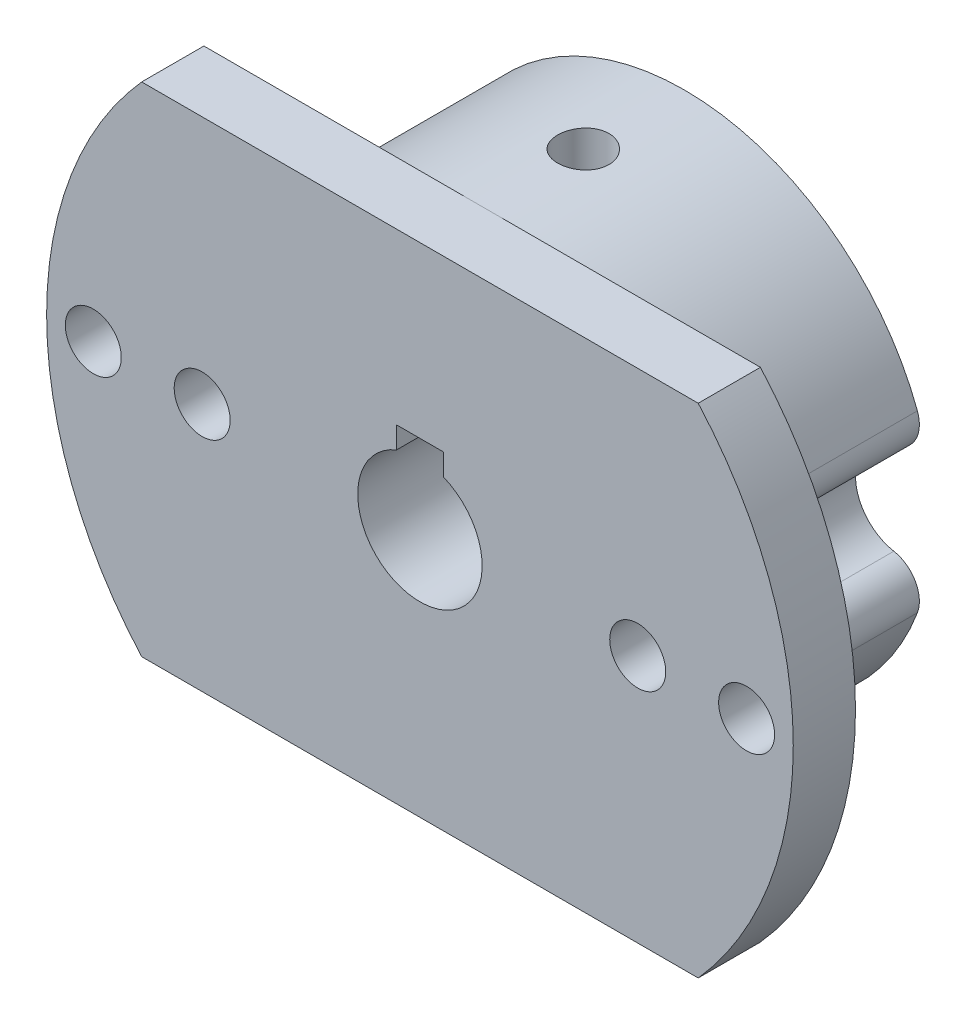
from build123d import *

# Parameters (mm, degrees)
BOSS_EXTRUDE1_DEPTH          = 4
BOSS_EXTRUDE2_REACH          = 35.481
M3_CLEARANCE_HOLE1_D         = 3.6
F_8_0MM_DOWEL_HOLE1_D        = 8
FILLET1_R                    = 2
M4X0_7_TAPPED_HOLE1_REACH    = 45.081
M4X0_7_TAPPED_HOLE1_BORE_R   = 1.65
M2_5X0_45_TAPPED_HOLE1_D     = 2.05
M2_5X0_45_TAPPED_HOLE1_DEPTH = 8
M2_5X0_45_TAPPED_HOLE1_TIP   = 0.615882135
SKETCH14_W                   = 3
SKETCH14_H                   = 3
CUT_EXTRUDE1_DEPTH           = 34.481338272


with BuildPart() as part:
    # Sketch1 → Boss-Extrude1 (new body)
    with BuildSketch(Plane(origin=(0, 0, 12), x_dir=(-1, 0, 0), z_dir=(0, 0, -1))):
        with BuildLine():
            Line((17.88854382, 16), (-17.88854382, 16))
            ThreePointArc((-17.88854382, 16), (-24, 0), (-17.88854382, -16))
            Line((-17.88854382, -16), (17.88854382, -16))
            ThreePointArc((17.88854382, -16), (24, 0), (17.88854382, 16))
        make_face()
    extrude(amount=-BOSS_EXTRUDE1_DEPTH)

    # Sketch3 → Boss-Extrude2 (add, up to next)
    with BuildSketch(Plane(origin=(0, 0, -1), x_dir=(-1, 0, 0), z_dir=(0, 0, -1)), mode=Mode.PRIVATE) as boss_extrude2_sk1:
        with BuildLine():
            ThreePointArc((-15.821428571, -2.383778085), (0, -16), (15.821428571, -2.383778085))
            ThreePointArc((15.821428571, -2.383778085), (11, 0), (15.821428571, 2.383778085))
            ThreePointArc((15.821428571, 2.383778085), (0, 16), (-15.821428571, 2.383778085))
            ThreePointArc((-15.821428571, 2.383778085), (-11, 0), (-15.821428571, -2.383778085))
        make_face()
    boss_extrude2_tool1 = extrude(boss_extrude2_sk1.sketch, amount=-BOSS_EXTRUDE2_REACH, mode=Mode.PRIVATE) - part.part
    add(boss_extrude2_tool1.solids().sort_by_distance((0, 0, -1))[0])

    # M3 Clearance Hole1 (through all)
    with Locations(Plane(origin=(0, 0, 12), x_dir=(-1, 0, 0), z_dir=(0, 0, -1))):
        with Locations((21, 0), (-21, 0), (-14, 0), (14, 0)):
            Hole(M3_CLEARANCE_HOLE1_D / 2)

    # Ø8.0mm Dowel Hole1 (through all)
    with Locations(Plane(origin=(0, 0, -1), x_dir=(-1, 0, 0), z_dir=(0, 0, -1))):
        with Locations((0, 0)):
            Hole(F_8_0MM_DOWEL_HOLE1_D / 2)

    # Fillet1
    fillet1_edges = [part.edges().sort_by_distance(p)[0] for p in [
        (-15.821428571, -2.383778085, 5.5),
        (-15.821428571, 2.383778085, 5.5),
        (15.821428571, 2.383778085, 5.5),
        (15.821428571, -2.383778085, 5.5),
    ]]
    fillet(fillet1_edges, radius=FILLET1_R)

    # M4x0.7 Tapped Hole1 bore → M4x0.7 Tapped Hole1 (cut, up to next)
    with BuildSketch(Plane(origin=(0, 16, 0), x_dir=(1, 0, 0), z_dir=(0, 1, 0)), mode=Mode.PRIVATE) as m4x0_7_tapped_hole1_sk1:
        with Locations((0, -5.5)):
            Circle(M4X0_7_TAPPED_HOLE1_BORE_R)
    m4x0_7_tapped_hole1_tool1 = extrude(m4x0_7_tapped_hole1_sk1.sketch, amount=-M4X0_7_TAPPED_HOLE1_REACH, mode=Mode.PRIVATE) & part.part
    add(m4x0_7_tapped_hole1_tool1.solids().sort_by_distance((0, 16, 5.5))[0], mode=Mode.SUBTRACT)

    # M2.5x0.45 Tapped Hole1
    with Locations(Plane(origin=(0, -16, 0), x_dir=(-1, 0, 0), z_dir=(0, -1, 0))):
        with Locations((0, -4), (0, -10)):
            Hole(M2_5X0_45_TAPPED_HOLE1_D / 2, depth=M2_5X0_45_TAPPED_HOLE1_DEPTH)
            with Locations((0, 0, -(M2_5X0_45_TAPPED_HOLE1_DEPTH + M2_5X0_45_TAPPED_HOLE1_TIP / 2))):  # 118° drill point
                Cone(0, M2_5X0_45_TAPPED_HOLE1_D / 2, M2_5X0_45_TAPPED_HOLE1_TIP, mode=Mode.SUBTRACT)

    # Sketch14 → Cut-Extrude1 (cut, through all)
    with BuildSketch(Plane(origin=(0, 0, -1), x_dir=(-1, 0, 0), z_dir=(0, 0, -1))):
        with Locations((0, 3.6)):
            Rectangle(SKETCH14_W, SKETCH14_H)
    extrude(amount=-CUT_EXTRUDE1_DEPTH, mode=Mode.SUBTRACT)


solid = part.part
